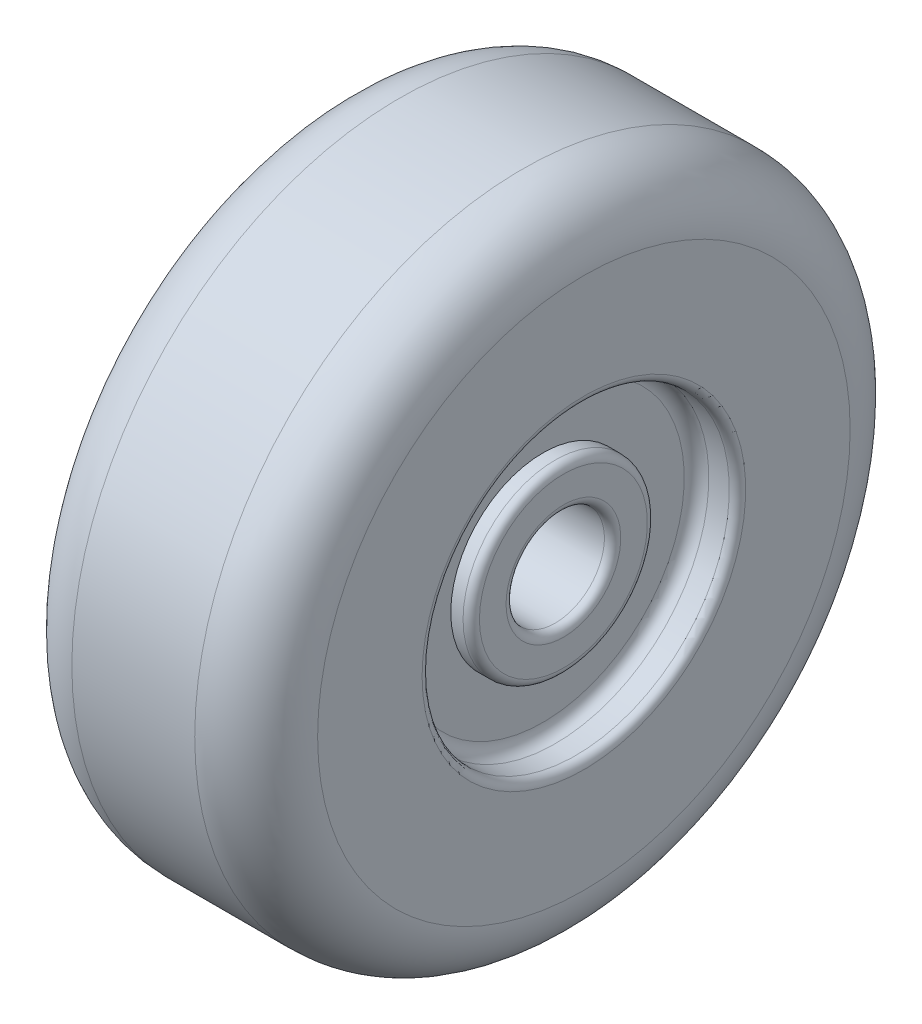
from build123d import *


with BuildPart() as part:
    # Esboço2 → Revolução1 (revolve)
    with BuildSketch(Plane.XY, mode=Mode.PRIVATE) as revolu_o1_sk:
        with BuildLine():
            Line((-2.3, 1.2), (2.3, 1.2))
            ThreePointArc((2.3, 1.2), (2.441421356, 1.258578644), (2.5, 1.4))
            Line((2.5, 1.4), (2.5, 2.05))
            ThreePointArc((2.5, 2.05), (2.441421356, 2.191421356), (2.3, 2.25))
            Line((2.3, 2.25), (2, 2.25))
            Line((2, 2.25), (2, 3.45))
            ThreePointArc((2, 3.45), (2.087867966, 3.662132034), (2.3, 3.75))
            Line((2.3, 3.75), (2.8, 3.75))
            ThreePointArc((2.8, 3.75), (2.941421356, 3.808578644), (3, 3.95))
            Line((3, 3.95), (3, 6.5))
            ThreePointArc((3, 6.5), (2.560660172, 7.560660172), (1.5, 8))
            Line((1.5, 8), (-1.5, 8))
            ThreePointArc((-1.5, 8), (-2.560660172, 7.560660172), (-3, 6.5))
            Line((-3, 6.5), (-3, 3.95))
            ThreePointArc((-3, 3.95), (-2.941421356, 3.808578644), (-2.8, 3.75))
            Line((-2.8, 3.75), (-2.3, 3.75))
            ThreePointArc((-2.3, 3.75), (-2.087867966, 3.662132034), (-2, 3.45))
            Line((-2, 3.45), (-2, 2.25))
            Line((-2, 2.25), (-2.3, 2.25))
            ThreePointArc((-2.3, 2.25), (-2.441421356, 2.191421356), (-2.5, 2.05))
            Line((-2.5, 2.05), (-2.5, 1.4))
            ThreePointArc((-2.5, 1.4), (-2.441421356, 1.258578644), (-2.3, 1.2))
        make_face()
    revolve(revolu_o1_sk.sketch.rotate(Axis((0, 0, 0), (1, 0, 0)), 90), axis=Axis((0, 0, 0), (1, 0, 0)))


solid = part.part
